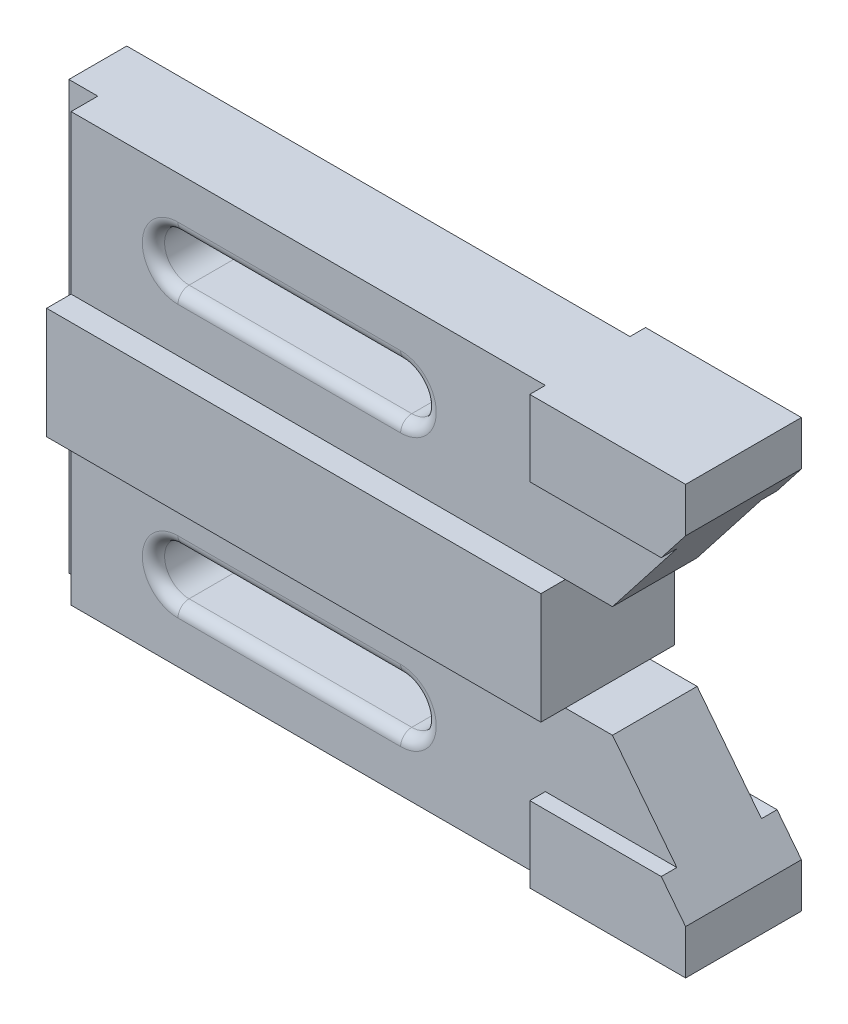
from build123d import *

# Parameters (mm, degrees)
BOSS_EXTRUDE1_DEPTH = 9.5
SKETCH5_W           = 117.5
SKETCH5_H           = 25
BOSS_EXTRUDE4_DEPTH = 15
BOSS_EXTRUDE5_DEPTH = 13
SKETCH7_W           = 6.5
SKETCH7_H           = 11.5
CUT_EXTRUDE1_DEPTH  = 178.045191971
FILLET1_R           = 2.5


with BuildPart() as part:
    # Sketch1 → Boss-Extrude1 (new, symmetric)
    with BuildSketch(Plane.XY):
        Polygon((0, 0), (-148, 0), (-148, 96), (0, 96), (0, 86), (-19.922783476, 60.5), (-30.5, 60.5), (-30.5, 35.5), (-19.922783476, 35.5), (0, 10), align=None)
        with BuildLine():
            Line((-117.5, 84), (-67.5, 84))
            ThreePointArc((-67.5, 84), (-62, 78.5), (-67.5, 73))
            Line((-67.5, 73), (-117.5, 73))
            ThreePointArc((-117.5, 73), (-123, 78.5), (-117.5, 84))
        make_face(mode=Mode.SUBTRACT)
        with BuildLine():
            Line((-117.5, 23), (-67.5, 23))
            ThreePointArc((-67.5, 23), (-62, 17.5), (-67.5, 12))
            Line((-67.5, 12), (-117.5, 12))
            ThreePointArc((-117.5, 12), (-123, 17.5), (-117.5, 23))
        make_face(mode=Mode.SUBTRACT)
    extrude(amount=BOSS_EXTRUDE1_DEPTH, both=True)

    # Sketch5 → Boss-Extrude4 (add, symmetric)
    with BuildSketch(Plane.XY):
        with Locations((-89.25, 48)):
            Rectangle(SKETCH5_W, SKETCH5_H)
    extrude(amount=BOSS_EXTRUDE4_DEPTH, both=True)

    # Sketch6 → Boss-Extrude5 (add, symmetric)
    with BuildSketch(Plane.XY):
        Polygon((-5.468999386, 79), (-35, 79), (-35, 96), (0, 96), (0, 86), align=None)
        Polygon((-5.468999386, 17), (-35, 17), (-35, 0), (0, 0), (0, 10), align=None)
    extrude(amount=BOSS_EXTRUDE5_DEPTH, both=True)

    # Sketch7 → Cut-Extrude1 (cut, through all)
    with BuildSketch(Plane(origin=(0, 96, 0), x_dir=(1, 0, 0), z_dir=(0, 1, 0))):
        with Locations((-144.75, -9.25)):
            Rectangle(SKETCH7_W, SKETCH7_H)
    extrude(amount=-CUT_EXTRUDE1_DEPTH, mode=Mode.SUBTRACT)

    # Fillet1
    fillet1_edges = [part.edges().sort_by_distance(p)[0] for p in [
        (-123, 78.5, -9.5),
        (-92.5, 73, -9.5),
        (-62, 78.5, -9.5),
        (-92.5, 84, -9.5),
        (-123, 78.5, 9.5),
        (-92.5, 73, 9.5),
        (-62, 78.5, 9.5),
        (-92.5, 84, 9.5),
        (-123, 17.5, -9.5),
        (-92.5, 12, -9.5),
        (-62, 17.5, -9.5),
        (-92.5, 23, -9.5),
        (-123, 17.5, 9.5),
        (-92.5, 12, 9.5),
        (-62, 17.5, 9.5),
        (-92.5, 23, 9.5),
    ]]
    fillet(fillet1_edges, radius=FILLET1_R)


solid = part.part
